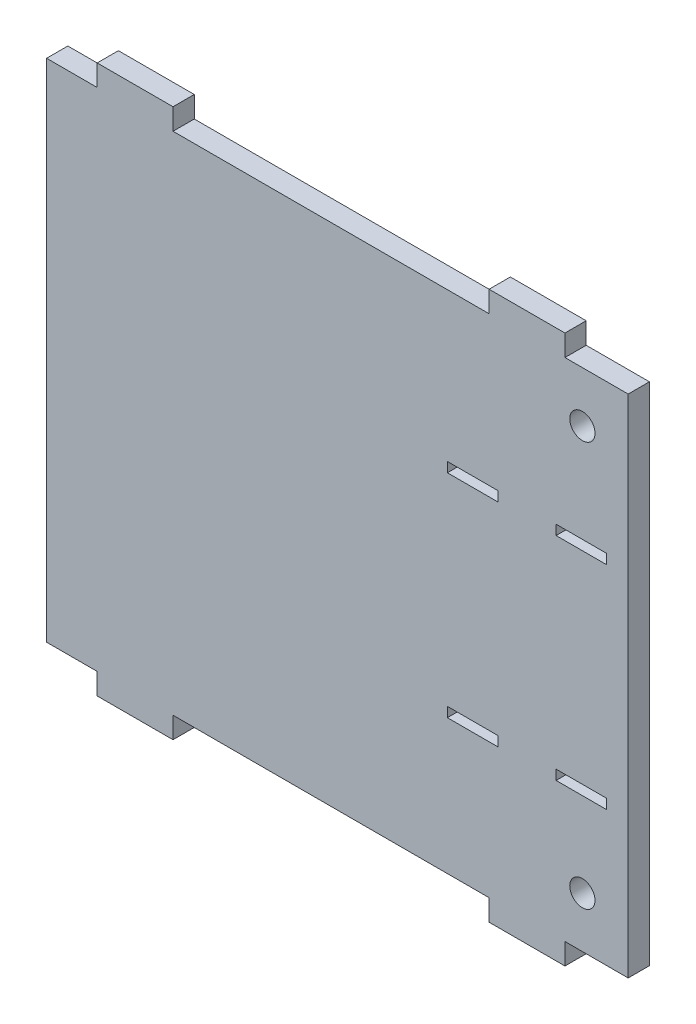
from build123d import *

# Parameters (mm, degrees)
SKETCH1_W          = 50.8
SKETCH1_H          = 127
BODY_DEPTH         = 5.334
SKETCH3_W          = 19.05
SKETCH3_H          = 5.334
TOP_TAB_DEPTH      = 5.334
SKETCH4_W          = 19.05
SKETCH4_H          = 5.334
BOT_TAB_DEPTH      = 5.334
SKETCH5_W          = 12.7
SKETCH5_H          = 2.4638
MIDDLE_CUTS_DEPTH  = 74.564469087
SKETCH6_R          = 3.175
BOLTHOLES_DEPTH    = 74.564469087
SKETCH8_W          = 5.334
SKETCH8_H          = 127
PIC_PLATFORM_DEPTH = 95.25
SKETCH10_W         = 19.05
SKETCH10_H         = 5.334
LEFTEXTRUDE_DEPTH  = 5.334
SKETCH11_W         = 19.05
SKETCH11_H         = 5.334
RIGHTEXTRUDE_DEPTH = 5.334


with BuildPart() as part:
    # Sketch1 → body (new body)
    with BuildSketch(Plane.XY):
        Rectangle(SKETCH1_W, SKETCH1_H)
    extrude(amount=BODY_DEPTH)

    # Sketch3 → Top tab (add)
    with BuildSketch(Plane(origin=(0, 63.5, 0), x_dir=(1, 0, 0), z_dir=(0, 1, 0))):
        with Locations((0, -2.667)):
            Rectangle(SKETCH3_W, SKETCH3_H)
    extrude(amount=TOP_TAB_DEPTH)

    # Sketch4 → Bot tab (add)
    with BuildSketch(Plane.XZ.offset(63.5)):
        with Locations((0, 2.667)):
            Rectangle(SKETCH4_W, SKETCH4_H)
    extrude(amount=BOT_TAB_DEPTH)

    # Sketch5 → middle cuts (cut, through all)
    with BuildSketch(Plane.XY.offset(5.334)):
        with Locations((-13.649999878, 24.909253458)):
            Rectangle(SKETCH5_W, SKETCH5_H)
        with Locations((13.649999878, -28.354546542)):
            Rectangle(SKETCH5_W, SKETCH5_H)
        with Locations((-13.649999878, -28.354546542)):
            Rectangle(SKETCH5_W, SKETCH5_H)
        with Locations((13.649999878, 24.909253458)):
            Rectangle(SKETCH5_W, SKETCH5_H)
    extrude(amount=-MIDDLE_CUTS_DEPTH, mode=Mode.SUBTRACT)

    # Sketch6 → BoltHoles (cut, through all)
    with BuildSketch(Plane.XY.offset(5.334)):
        with Locations((13.900024524, 50.8)):
            Circle(SKETCH6_R)
        with Locations((13.900024524, -50.8)):
            Circle(SKETCH6_R)
    extrude(amount=-BOLTHOLES_DEPTH, mode=Mode.SUBTRACT)

    # Sketch8 → PIC platform (add)
    with BuildSketch(Plane.ZY.offset(25.4)):
        with Locations((2.667, 0)):
            Rectangle(SKETCH8_W, SKETCH8_H)
    extrude(amount=PIC_PLATFORM_DEPTH)

    # Sketch10 → LeftExtrude (add)
    with BuildSketch(Plane(origin=(0, 63.5, 0), x_dir=(1, 0, 0), z_dir=(0, 1, 0))):
        with Locations((-98.425, -2.667)):
            Rectangle(SKETCH10_W, SKETCH10_H)
    extrude(amount=LEFTEXTRUDE_DEPTH)

    # Sketch11 → RightExtrude (add)
    with BuildSketch(Plane.XZ.offset(63.5)):
        with Locations((-98.425, 2.667)):
            Rectangle(SKETCH11_W, SKETCH11_H)
    extrude(amount=RIGHTEXTRUDE_DEPTH)


solid = part.part
